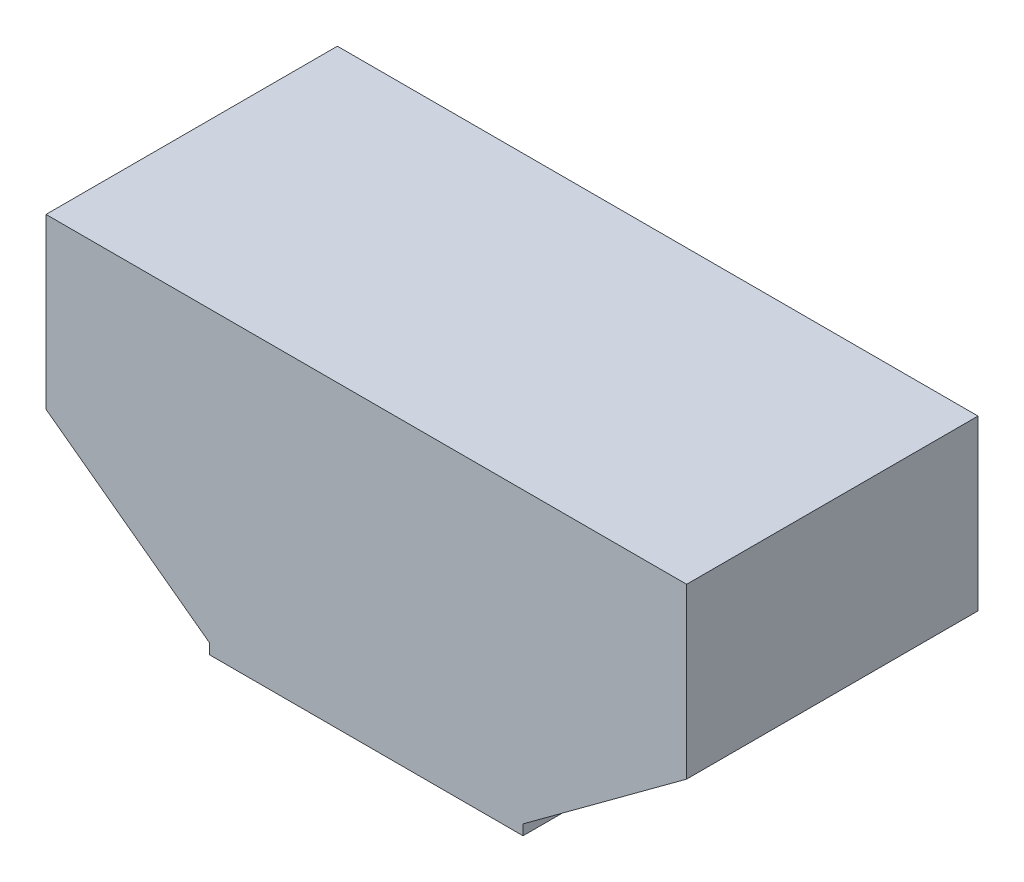
from build123d import *

# Parameters (mm, degrees)
BOSS_EXTRUDE1_DEPTH = 1074.42


with BuildPart() as part:
    # Sketch1 → Boss-Extrude1 (new body)
    with BuildSketch(Plane.XY):
        Polygon((-577.85, -2072.323643136), (577.85, -2072.323643136), (577.85, -2034.223643136), (1181.1, -1589.723643136), (1181.1, -967.423643136), (-1181.1, -967.423643136), (-1181.1, -1589.723643136), (-577.85, -2034.223643136), align=None)
    extrude(amount=BOSS_EXTRUDE1_DEPTH)


solid = part.part
